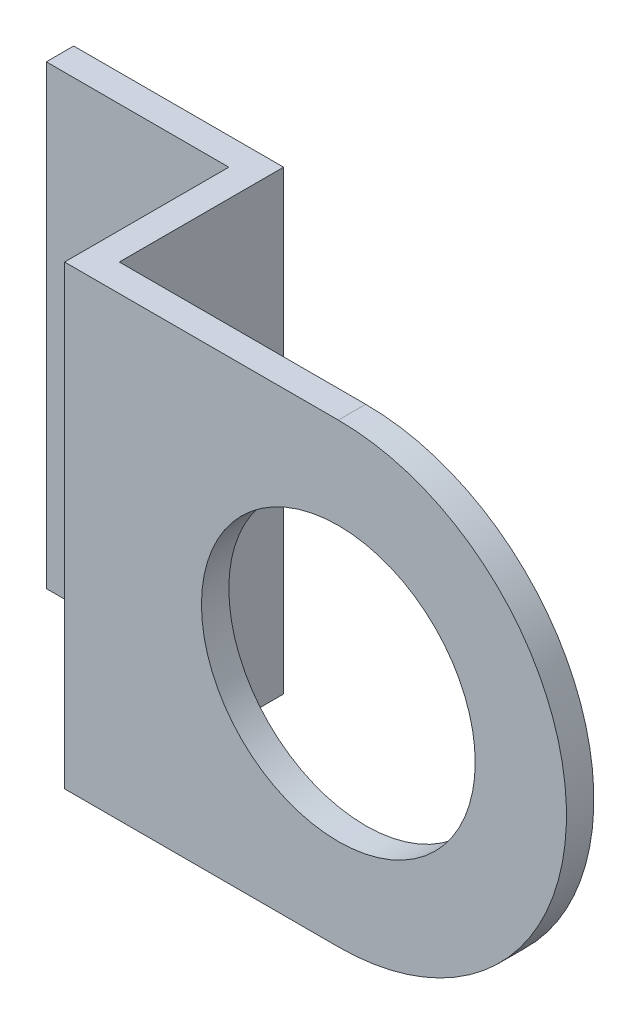
from build123d import *

# Parameters (mm, degrees)
SKETCH_1_R      = 30
EXTRUDE_1_DEPTH = 6
EXTRUDE_2_DEPTH = 50


with BuildPart() as part:
    # 草图1 → 凸台-拉伸1 (new body)
    with BuildSketch(Plane.XY):
        with BuildLine():
            Line((60, 50), (0, 50))
            Line((0, 50), (0, -50))
            Line((0, -50), (60, -50))
            ThreePointArc((60, -50), (110, 0), (60, 50))
        make_face()
        with Locations((60, 0)):
            Circle(SKETCH_1_R, mode=Mode.SUBTRACT)
    extrude(amount=EXTRUDE_1_DEPTH)

    # 草图2 → 凸台-拉伸2 (add, symmetric)
    with BuildSketch(Plane(origin=(0, 0, 0), x_dir=(1, 0, 0), z_dir=(0, 1, 0))):
        Polygon((0, 0), (0, 30), (-40, 30), (-40, 36), (6, 36), (6, 0), align=None)
    extrude(amount=EXTRUDE_2_DEPTH, both=True)


solid = part.part
